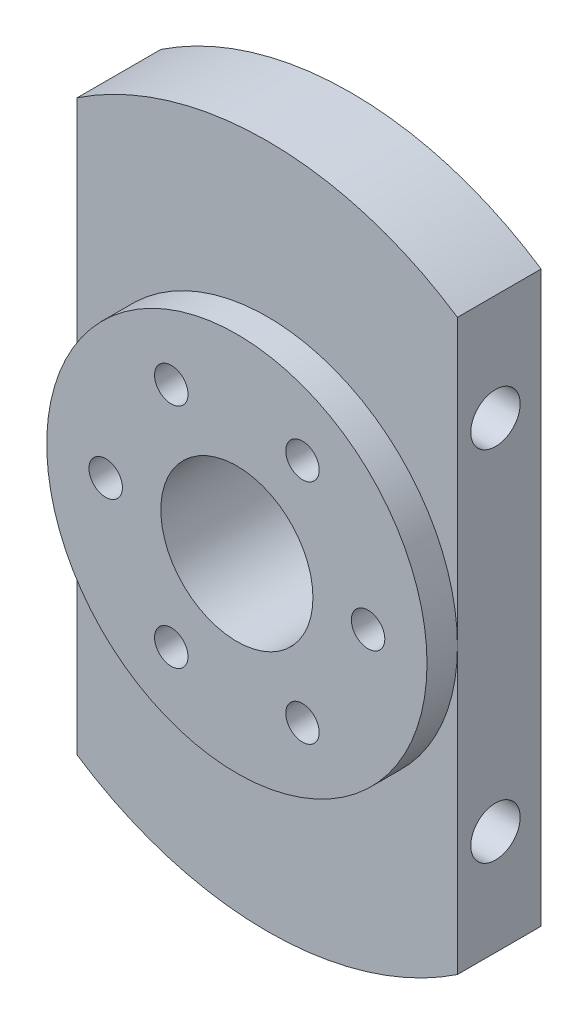
from build123d import *

# Parameters (mm, degrees)
SKETCH_1_R           = 45
EXTRUDE_1_DEPTH      = 15
SKETCH_6_R           = 10
CUT_EXTRUDE_5_DEPTH  = 26
SKETCH_7_R           = 2.2
CUT_EXTRUDE_6_DEPTH  = 66.383484153
CUT_EXTRUDE_7_DEPTH  = 66.383484153
SKETCH_9_R           = 3.25
CUT_EXTRUDE_8_DEPTH  = 69.92024376
SKETCH_11_R          = 4
CUT_EXTRUDE_9_DEPTH  = 9
CUT_EXTRUDE_START    = -4
CUT_EXTRUDE_10_DEPTH = 4


with BuildPart() as part:
    # 草图1 → 凸台-拉伸1 (new body)
    with BuildSketch(Plane.XY):
        Circle(SKETCH_1_R)
    extrude(amount=EXTRUDE_1_DEPTH)

    # 草图6 → 切除-拉伸5 (cut)
    with BuildSketch(Plane.XY.offset(15)):
        Circle(SKETCH_6_R)
    extrude(amount=-CUT_EXTRUDE_5_DEPTH, mode=Mode.SUBTRACT)

    # 草图7 → 切除-拉伸6 (cut, through all)
    with BuildSketch(Plane.XY.offset(15)):
        with Locations((17.25, 0)):
            Circle(SKETCH_7_R)
        with Locations((8.625, -14.938938215)):
            Circle(SKETCH_7_R)
        with Locations((-8.625, -14.938938215)):
            Circle(SKETCH_7_R)
        with Locations((-17.25, 0)):
            Circle(SKETCH_7_R)
        with Locations((-8.625, 14.938938215)):
            Circle(SKETCH_7_R)
        with Locations((8.625, 14.938938215)):
            Circle(SKETCH_7_R)
    extrude(amount=-CUT_EXTRUDE_6_DEPTH, mode=Mode.SUBTRACT)

    # 草图8 → 切除-拉伸7 (cut, through all)
    with BuildSketch(Plane.XY.offset(15)):
        with BuildLine():
            ThreePointArc((-25, 37.416573868), (-45, 0), (-25, -37.416573868))
            Line((-25, -37.416573868), (-25, 37.416573868))
        make_face()
        with BuildLine():
            Line((25, 37.416573868), (25, -37.416573868))
            ThreePointArc((25, -37.416573868), (39.686269666, -21.213203436), (45, 0))
            ThreePointArc((45, 0), (39.686269666, 21.213203436), (25, 37.416573868))
        make_face()
    extrude(amount=-CUT_EXTRUDE_7_DEPTH, mode=Mode.SUBTRACT)

    # 草图9 → 切除-拉伸8 (cut, through all)
    with BuildSketch(Plane(origin=(25, 0, 0), x_dir=(0, 0, -1), z_dir=(1, 0, 0))):
        with Locations((-6, 23.45)):
            Circle(SKETCH_9_R)
        with Locations((-6, -23.63)):
            Circle(SKETCH_9_R)
    extrude(amount=-CUT_EXTRUDE_8_DEPTH, mode=Mode.SUBTRACT)

    # 草图11 → 切除-拉伸9 (cut)
    with BuildSketch(Plane(origin=(0, 0, 0), x_dir=(-1, 0, 0), z_dir=(0, 0, -1))):
        with Locations((-8.625, 14.938938215)):
            Circle(SKETCH_11_R)
        with Locations((-17.25, 0)):
            Circle(SKETCH_11_R)
        with Locations((-8.625, -14.938938215)):
            Circle(SKETCH_11_R)
        with Locations((8.625, 14.938938215)):
            Circle(SKETCH_11_R)
        with Locations((8.625, -14.938938215)):
            Circle(SKETCH_11_R)
        with Locations((17.25, 0)):
            Circle(SKETCH_11_R)
    extrude(amount=-CUT_EXTRUDE_9_DEPTH, mode=Mode.SUBTRACT)

    # 草图13 → 切除-拉伸10 (cut)
    with BuildSketch(Plane.XY.offset(15).offset(CUT_EXTRUDE_START)):
        with BuildLine():
            ThreePointArc((25, 37.416573868), (0, 45), (-25, 37.416573868))
            Line((-25, 37.416573868), (-25, 2.6e-08))
            ThreePointArc((-25, 2.6e-08), (1.3e-08, 25), (25, 0))
            Line((25, 0), (25, 37.416573868))
        make_face()
        with BuildLine():
            ThreePointArc((25, 0), (-1.3e-08, -25), (-25, 2.6e-08))
            Line((-25, 2.6e-08), (-25, -37.416573868))
            ThreePointArc((-25, -37.416573868), (0, -45), (25, -37.416573868))
            Line((25, -37.416573868), (25, 0))
        make_face()
    extrude(amount=CUT_EXTRUDE_10_DEPTH, mode=Mode.SUBTRACT)


solid = part.part
